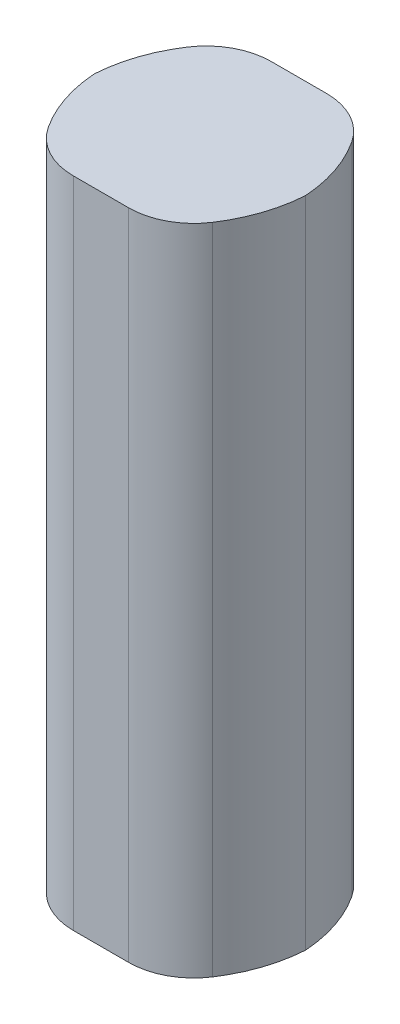
from build123d import *

# Parameters (mm, degrees)
BOSS_EXTRUDE1_DEPTH = 100.35
FILLET1_R           = 10


with BuildPart() as part:
    # Sketch1 → Boss-Extrude1 (new body)
    with BuildSketch(Plane(origin=(0, 0, 0), x_dir=(1, 0, 0), z_dir=(0, 1, 0))):
        with BuildLine():
            ThreePointArc((-16.2, 0), (-13.956480682, -8.355560366), (-8.664749957, -15.2))
            Line((-8.664749957, -15.2), (8.664749957, -15.2))
            ThreePointArc((8.664749957, -15.2), (13.956480682, -8.355560366), (16.2, 0))
            ThreePointArc((16.2, 0), (13.956480682, 8.355560366), (8.664749957, 15.2))
            Line((8.664749957, 15.2), (-8.664749957, 15.2))
            ThreePointArc((-8.664749957, 15.2), (-13.956480682, 8.355560366), (-16.2, 0))
        make_face()
    extrude(amount=BOSS_EXTRUDE1_DEPTH)

    # Fillet1
    fillet1_edges = [part.edges().sort_by_distance(p)[0] for p in [
        (-8.664749957, 50.175, 15.2),
        (8.664749957, 50.175, 15.2),
        (8.664749957, 50.175, -15.2),
        (-8.664749957, 50.175, -15.2),
    ]]
    fillet(fillet1_edges, radius=FILLET1_R)


solid = part.part
